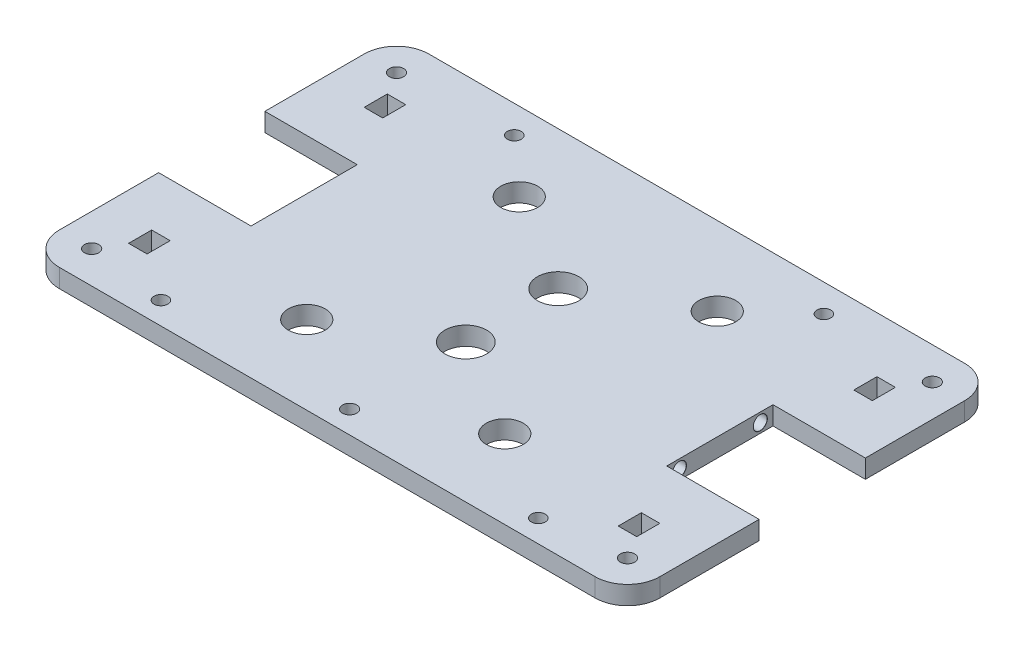
from build123d import *

# Parameters (mm, degrees)
SKETCH1_R                = 1.55
SKETCH1_R_2              = 1.5
SKETCH1_R_3              = 4.5
SKETCH1_R_4              = 4
SKETCH1_W                = 4
SKETCH1_H                = 5
BOSS_EXTRUDE1_DEPTH      = 4
OTW_R_3_0_3_1_AT_2_COUNT = 2
OTW_R_3_0_3_1_AT_2_PITCH = 17.5


with BuildPart() as part:
    # Sketch1 → Boss-Extrude1 (new body)
    with BuildSketch(Plane(origin=(0, 0, 0), x_dir=(1, 0, 0), z_dir=(0, 1, 0))):
        with BuildLine():
            Line((45, -11.5), (45, 11.5))
            Line((45, 11.5), (65, 11.5))
            Line((65, 11.5), (65, 33))
            ThreePointArc((65, 33), (62.949747468, 37.949747468), (58, 40))
            Line((58, 40), (-58, 40))
            ThreePointArc((-58, 40), (-62.949747468, 37.949747468), (-65, 33))
            Line((-65, 33), (-65, 11.5))
            Line((-65, 11.5), (-45, 11.5))
            Line((-45, 11.5), (-45, -11.5))
            Line((-45, -11.5), (-65, -11.5))
            Line((-65, -11.5), (-65, -33))
            ThreePointArc((-65, -33), (-62.949747468, -37.949747468), (-58, -40))
            Line((-58, -40), (58, -40))
            ThreePointArc((58, -40), (62.949747468, -37.949747468), (65, -33))
            Line((65, -33), (65, -11.5))
            Line((65, -11.5), (45, -11.5))
        make_face()
        with Locations(Location((58, 33, 0), (0, 0, 270))):
            Circle(SKETCH1_R, mode=Mode.SUBTRACT)
        with Locations(Location((58, -33, 0), (0, 0, 270))):
            Circle(SKETCH1_R, mode=Mode.SUBTRACT)
        with Locations(Location((-58, -33, 0), (0, 0, 270))):
            Circle(SKETCH1_R, mode=Mode.SUBTRACT)
        with Locations(Location((-58, 33, 0), (0, 0, 270))):
            Circle(SKETCH1_R, mode=Mode.SUBTRACT)
        with Locations(Location((33.5, 34, 0), (0, 0, 270))):
            Circle(SKETCH1_R_2, mode=Mode.SUBTRACT)
        with Locations(Location((-33.5, 34, 0), (0, 0, 90))):
            Circle(SKETCH1_R_2, mode=Mode.SUBTRACT)
        with Locations(Location((-40.847291444, -35.157580257, 0), (0, 0, 270))):
            Circle(SKETCH1_R_2, mode=Mode.SUBTRACT)
        with Locations(Location((0, -35.15624759, 0), (0, 0, 270))):
            Circle(SKETCH1_R, mode=Mode.SUBTRACT)
        with Locations(Location((40.847291444, -35.157580257, 0), (0, 0, 90))):
            Circle(SKETCH1_R_2, mode=Mode.SUBTRACT)
        with Locations(Location((0, -10, 0), (0, 0, 270))):
            Circle(SKETCH1_R_3, mode=Mode.SUBTRACT)
        with Locations(Location((0, 10, 0), (0, 0, 90))):
            Circle(SKETCH1_R_3, mode=Mode.SUBTRACT)
        with Locations(Location((21.434820624, -23, 0), (0, 0, 270))):
            Circle(SKETCH1_R_4, mode=Mode.SUBTRACT)
        with Locations(Location((-21.434820624, -23, 0), (0, 0, 90))):
            Circle(SKETCH1_R_4, mode=Mode.SUBTRACT)
        with Locations(Location((-21.434820624, 23, 0), (0, 0, 270))):
            Circle(SKETCH1_R_4, mode=Mode.SUBTRACT)
        with Locations(Location((21.434820624, 23, 0), (0, 0, 90))):
            Circle(SKETCH1_R_4, mode=Mode.SUBTRACT)
        with Locations((53, -25.5)):
            Rectangle(SKETCH1_W, SKETCH1_H, mode=Mode.SUBTRACT)
        with Locations((53, 25.5)):
            Rectangle(SKETCH1_W, SKETCH1_H, mode=Mode.SUBTRACT)
        with Locations((-53, -25.5)):
            Rectangle(SKETCH1_W, SKETCH1_H, mode=Mode.SUBTRACT)
        with Locations((-53, 25.5)):
            Rectangle(SKETCH1_W, SKETCH1_H, mode=Mode.SUBTRACT)
    extrude(amount=BOSS_EXTRUDE1_DEPTH)

    # Szkic5 → Otwór Ø3.0 (3)1 (revolve, cut)
    with BuildSketch(Plane(origin=(-45, 2, -8.75), x_dir=(0, 0, 1), z_dir=(0, 1, 0))):
        Polygon((0, 0), (0, 20.901290929), (1.5, 20), (1.5, 0.025), (1.525, 0), align=None)
    otw_r_3_0_3_1 = revolve(axis=Axis((-51.35, 2, -8.75), (1, 0, 0)), mode=Mode.SUBTRACT)

    # Otwór Ø3.0 (3)1 at 2: Otwór Ø3.0 (3)1 ×2
    with Locations(*[(0, 0, i * OTW_R_3_0_3_1_AT_2_PITCH) for i in range(1, OTW_R_3_0_3_1_AT_2_COUNT)]):
        add(otw_r_3_0_3_1, mode=Mode.SUBTRACT)

    # Lustro1: Otwór Ø3.0 (3)1 across plane
    add(otw_r_3_0_3_1.mirror(Plane(origin=(0, 0, 0), x_dir=(0, 0, 1), z_dir=(1, 0, 0))), mode=Mode.SUBTRACT)

    # Lustro1 copy 1 sketch → Lustro1 copy 1 (revolve, cut)
    with BuildSketch(Plane(origin=(45, 2, 8.75), x_dir=(0, 0, 1), z_dir=(0, 1, 0))):
        Polygon((0, 0), (0, -20.901290929), (1.5, -20), (1.5, -0.025), (1.525, 0), align=None)
    revolve(axis=Axis((51.35, 2, 8.75), (1, 0, 0)), mode=Mode.SUBTRACT)


solid = part.part
